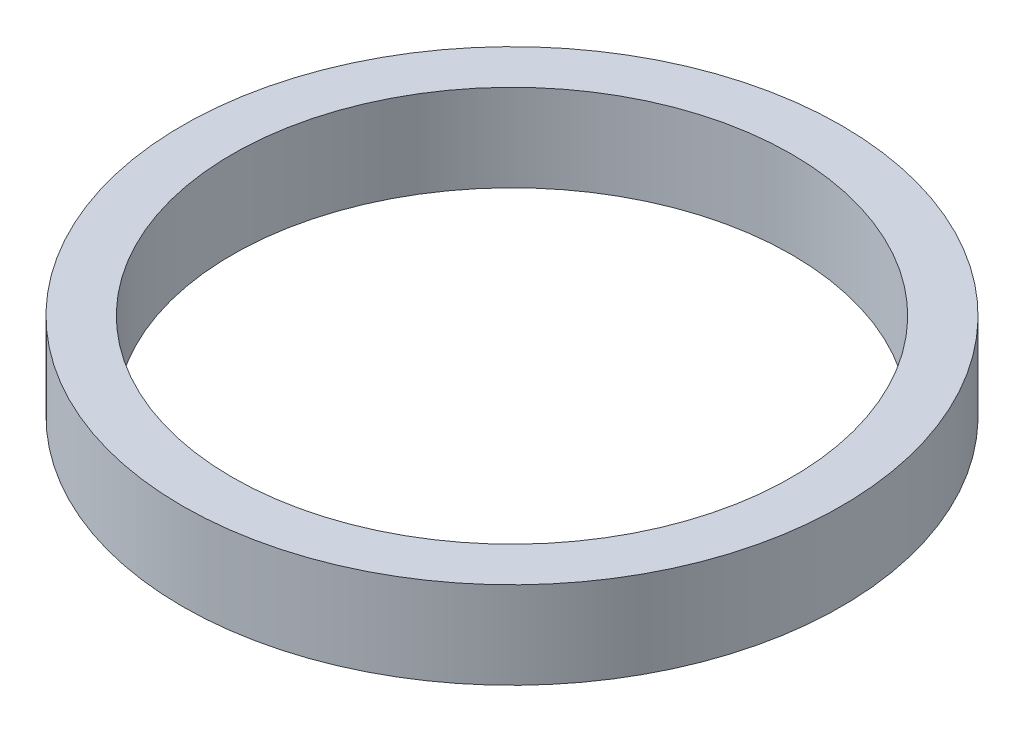
from build123d import *

# Parameters (mm, degrees)
SKETCH1_R           = 53
SKETCH1_R_2         = 45
BOSS_EXTRUDE1_DEPTH = 14
SKETCH2_R           = 2.4
CUT_EXTRUDE1_DEPTH  = 4
SKETCH3_R           = 1.6
CUT_EXTRUDE2_DEPTH  = 6


with BuildPart() as part:
    # Sketch1 → Boss-Extrude1 (new body)
    with BuildSketch(Plane(origin=(0, 0, 0), x_dir=(1, 0, 0), z_dir=(0, 1, 0))):
        with Locations(Location((0, 0, 0), (0, 0, 270))):
            Circle(SKETCH1_R)
        with Locations(Location((0, 0, 0), (0, 0, 270))):
            Circle(SKETCH1_R_2, mode=Mode.SUBTRACT)
    extrude(amount=BOSS_EXTRUDE1_DEPTH)

    # Sketch2 → Cut-Extrude1 (cut)
    with BuildSketch(Plane.XZ):
        with Locations(Location((0, 49, 0), (0, 0, 270))):
            Circle(SKETCH2_R)
        with Locations(Location((42.435244785, 24.5, 0), (0, 0, 270))):
            Circle(SKETCH2_R)
        with Locations(Location((42.435244785, -24.5, 0), (0, 0, 270))):
            Circle(SKETCH2_R)
        with Locations(Location((0, -49, 0), (0, 0, 270))):
            Circle(SKETCH2_R)
        with Locations(Location((-42.435244785, -24.5, 0), (0, 0, 270))):
            Circle(SKETCH2_R)
        with Locations(Location((-42.435244785, 24.5, 0), (0, 0, 270))):
            Circle(SKETCH2_R)
    extrude(amount=-CUT_EXTRUDE1_DEPTH, mode=Mode.SUBTRACT)

    # Sketch3 → Cut-Extrude2 (cut)
    with BuildSketch(Plane.XZ):
        with Locations(Location((0, 49, 0), (0, 0, 270))):
            Circle(SKETCH3_R)
        with Locations(Location((42.435244785, 24.5, 0), (0, 0, 270))):
            Circle(SKETCH3_R)
        with Locations(Location((42.435244785, -24.5, 0), (0, 0, 270))):
            Circle(SKETCH3_R)
        with Locations(Location((0, -49, 0), (0, 0, 270))):
            Circle(SKETCH3_R)
        with Locations(Location((-42.435244785, 24.5, 0), (0, 0, 270))):
            Circle(SKETCH3_R)
        with Locations(Location((-42.435244785, -24.5, 0), (0, 0, 270))):
            Circle(SKETCH3_R)
    extrude(amount=-CUT_EXTRUDE2_DEPTH, mode=Mode.SUBTRACT)


solid = part.part
